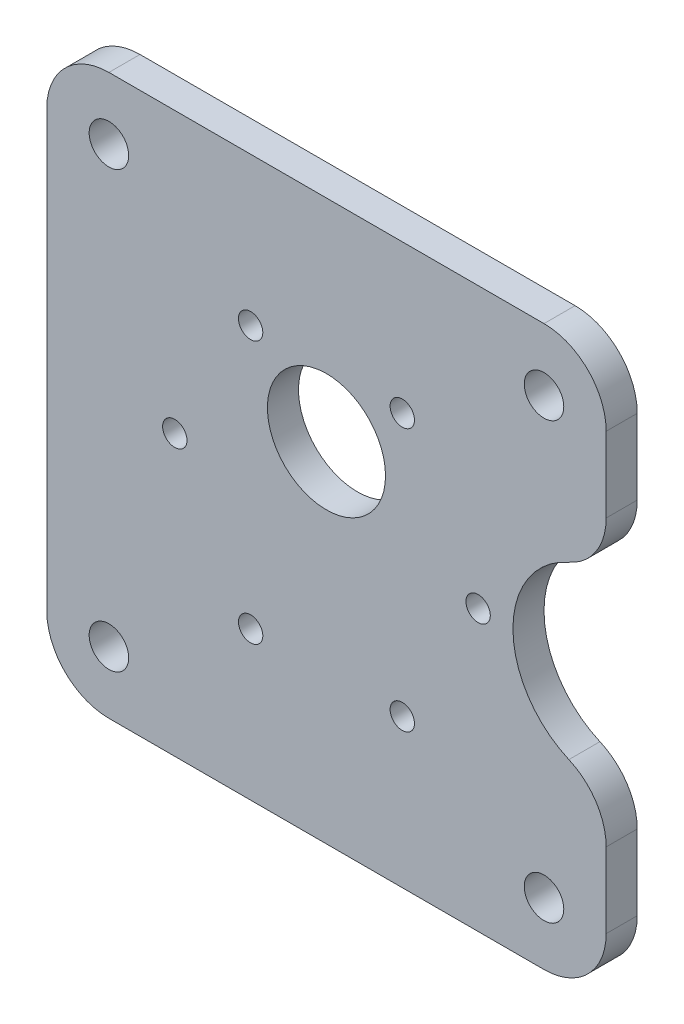
from build123d import *

# Parameters (mm, degrees)
SKETCH1_R           = 2.0193
SKETCH1_R_2         = 1.2446
SKETCH1_R_3         = 6.0325
BOSS_EXTRUDE1_DEPTH = 1.5875
FILLET2_R           = 6.35


with BuildPart() as part:
    # Sketch1 → Boss-Extrude1 (new, symmetric)
    with BuildSketch(Plane.XY):
        with BuildLine():
            Line((28.575, 28.575), (-28.575, 28.575))
            Line((-28.575, 28.575), (-28.575, -28.575))
            Line((-28.575, -28.575), (28.575, -28.575))
            Line((28.575, -28.575), (28.575, -9.525))
            ThreePointArc((28.575, -9.525), (19.05, 0), (28.575, 9.525))
            Line((28.575, 9.525), (28.575, 28.575))
        make_face()
        with Locations((-22.225, -22.225)):
            Circle(SKETCH1_R, mode=Mode.SUBTRACT)
        with Locations((-7.747, -13.418197606)):
            Circle(SKETCH1_R_2, mode=Mode.SUBTRACT)
        with Locations((22.225, -22.225)):
            Circle(SKETCH1_R, mode=Mode.SUBTRACT)
        with Locations((7.747, -13.418197606)):
            Circle(SKETCH1_R_2, mode=Mode.SUBTRACT)
        with Locations((15.494, 0)):
            Circle(SKETCH1_R_2, mode=Mode.SUBTRACT)
        with Locations((-15.494, 0)):
            Circle(SKETCH1_R_2, mode=Mode.SUBTRACT)
        with Locations((-7.747, 13.418197606)):
            Circle(SKETCH1_R_2, mode=Mode.SUBTRACT)
        with Locations((-22.225, 22.225)):
            Circle(SKETCH1_R, mode=Mode.SUBTRACT)
        with Locations((0, 7.0104)):
            Circle(SKETCH1_R_3, mode=Mode.SUBTRACT)
        with Locations((7.747, 13.418197606)):
            Circle(SKETCH1_R_2, mode=Mode.SUBTRACT)
        with Locations((22.225, 22.225)):
            Circle(SKETCH1_R, mode=Mode.SUBTRACT)
    extrude(amount=BOSS_EXTRUDE1_DEPTH, both=True)

    # Fillet2
    fillet2_edges = [part.edges().sort_by_distance(p)[0] for p in [
        (28.575, -9.525, 0),
        (28.575, -28.575, 0),
        (-28.575, -28.575, 0),
        (-28.575, 28.575, 0),
        (28.575, 28.575, 0),
        (28.575, 9.525, 0),
    ]]
    fillet(fillet2_edges, radius=FILLET2_R)


solid = part.part
